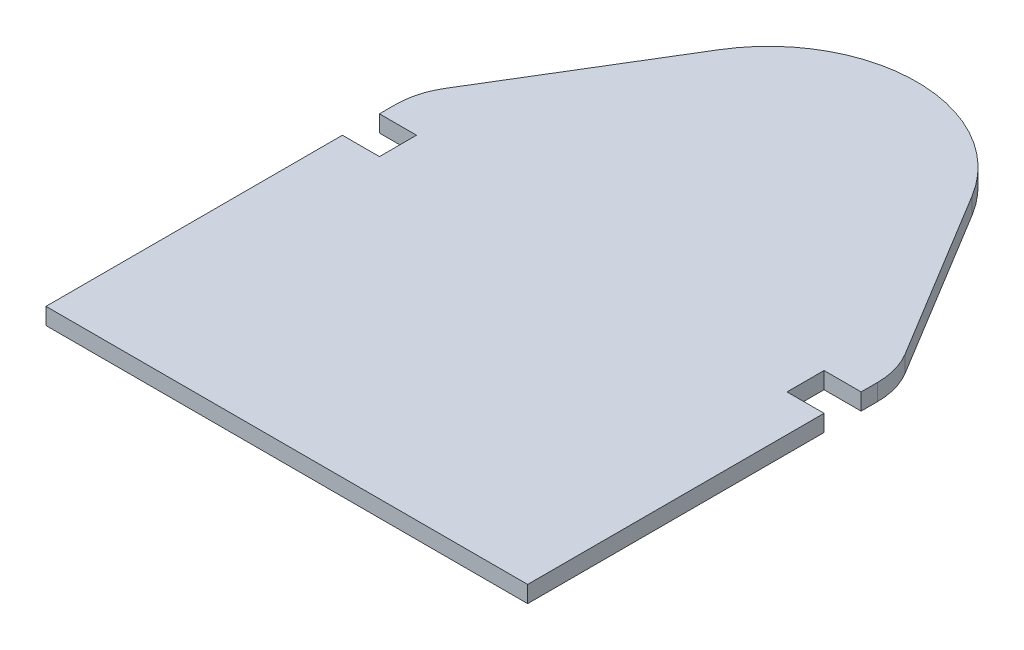
from build123d import *

# Parameters (mm, degrees)
EXTRUDE_1_DEPTH     = 4.5
FILLET_1_R          = 20
SKETCH_2_W          = 10
SKETCH_2_H          = 10
CUT_EXTRUDE_1_DEPTH = 116.19657113


with BuildPart() as part:
    # 스케치1 → 보스-돌출1 (new body)
    with BuildSketch(Plane(origin=(0, 0, 0), x_dir=(1, 0, 0), z_dir=(0, 1, 0))):
        with BuildLine():
            Line((-65, 25), (-34.194351712, 75.754428709))
            ThreePointArc((-34.194351712, 75.754428709), (0, 95), (34.194351712, 75.754428709))
            Line((34.194351712, 75.754428709), (65, 25))
            Line((65, 25), (65, -75))
            Line((65, -75), (-65, -75))
            Line((-65, -75), (-65, 25))
        make_face()
    extrude(amount=EXTRUDE_1_DEPTH)

    # 필렛1
    fillet_1_edges = [part.edges().sort_by_distance(p)[0] for p in [
        (-65, 2.25, -25),
        (65, 2.25, -25),
    ]]
    fillet(fillet_1_edges, radius=FILLET_1_R)

    # 스케치2 → 컷-돌출1 (cut, through all)
    with BuildSketch(Plane(origin=(0, 4.5, 0), x_dir=(1, 0, 0), z_dir=(0, 1, 0))):
        with Locations((-60, 10)):
            Rectangle(SKETCH_2_W, SKETCH_2_H)
        with Locations((60, 10)):
            Rectangle(SKETCH_2_W, SKETCH_2_H)
    extrude(amount=-CUT_EXTRUDE_1_DEPTH, mode=Mode.SUBTRACT)


solid = part.part
